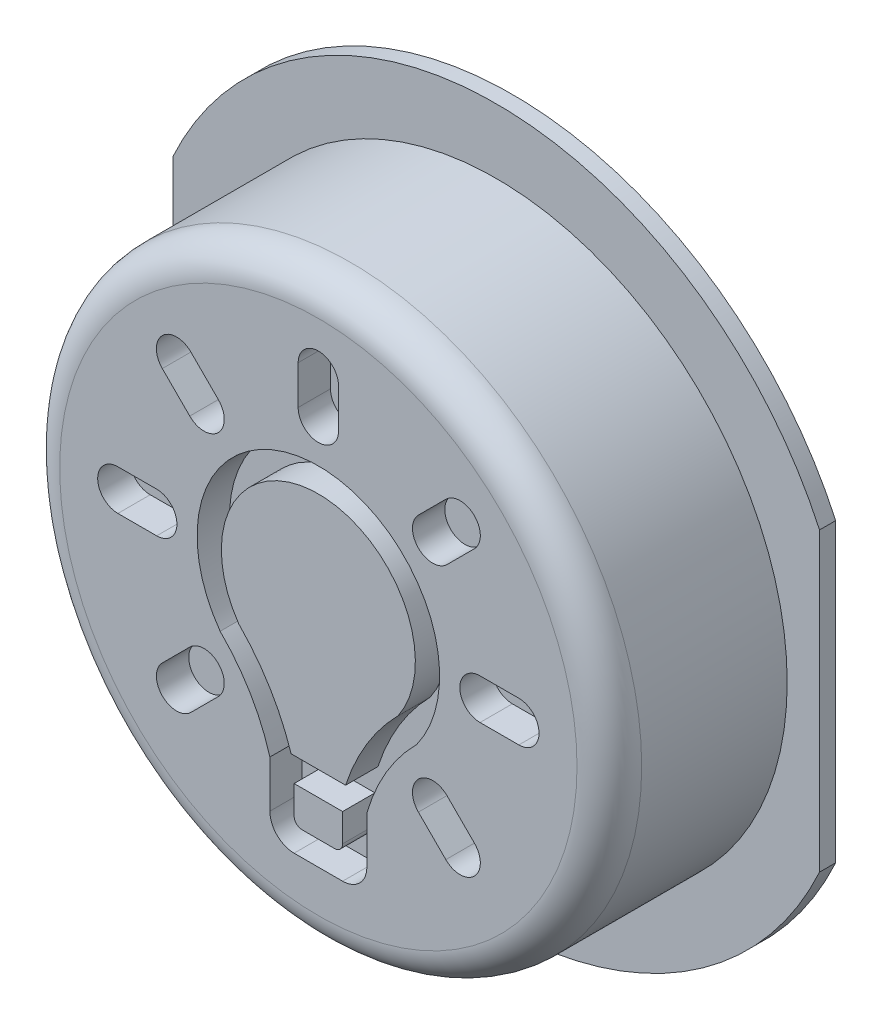
from build123d import *

# Parameters (mm, degrees)
ESBO_O1_R                = 9
RESSALTO_EXTRUS_O1_DEPTH = 6
FILETE1_R                = 1
CASCA1_T                 = -2
ESBO_O2_W                = 8.35
ESBO_O2_H                = 8.35
ESBO_O2_W_2              = 4.35
ESBO_O2_H_2              = 4.35
RESSALTO_EXTRUS_O2_DEPTH = 4
FILETE2_R                = 1
CORTE_EXTRUS_O2_DEPTH    = 1
ESBO_O6_R                = 11
ESBO_O6_R_2              = 9
RESSALTO_EXTRUS_O3_DEPTH = 0.5
CORTE_EXTRUS_O4_DEPTH    = 17.673332001
ESBO_O8_W                = 4.35
ESBO_O8_H                = 4.35
RESSALTO_EXTRUS_O4_DEPTH = 2


with BuildPart() as part:
    # Esboço1 → Ressalto-extrusão1 (new body)
    with BuildSketch(Plane.XY):
        Circle(ESBO_O1_R)
    extrude(amount=RESSALTO_EXTRUS_O1_DEPTH)

    # Filete1
    filete1_edges = [part.edges().sort_by_distance(p)[0] for p in [
        (-9, 0, 6),
    ]]
    fillet(filete1_edges, radius=FILETE1_R)

    # Casca1
    casca1_openings = [part.faces().sort_by_distance(p)[0] for p in [
        (0, 0, 0),
    ]]
    offset(amount=CASCA1_T, openings=casca1_openings, kind=Kind.INTERSECTION)

    # Esboço2 → Ressalto-extrusão2 (add)
    with BuildSketch(Plane(origin=(0, 0, 4), x_dir=(-1, 0, 0), z_dir=(0, 0, -1))):
        Rectangle(ESBO_O2_W, ESBO_O2_H)
        Rectangle(ESBO_O2_W_2, ESBO_O2_H_2, mode=Mode.SUBTRACT)
    extrude(amount=RESSALTO_EXTRUS_O2_DEPTH)

    # Filete2
    filete2_edges = [part.edges().sort_by_distance(p)[0] for p in [
        (-4.175, -4.175, 2),
        (-4.175, 4.175, 2),
        (4.175, 4.175, 2),
        (4.175, -4.175, 2),
    ]]
    fillet(filete2_edges, radius=FILETE2_R)

    # Esboço4 → Corte-extrusão2 (cut)
    # profile 1 of 8: a face of its own
    with BuildSketch(Plane.XY.offset(6)):
        with BuildLine():
            Line((-0.625, 6.5), (-0.625, 5.3))
            ThreePointArc((-0.625, 5.3), (0, 4.675), (0.625, 5.3))
            Line((0.625, 5.3), (0.625, 6.5))
            ThreePointArc((0.625, 6.5), (0, 7.125), (-0.625, 6.5))
        make_face()
    # profile 2 of 8: a face of its own
    with BuildSketch(Plane.XY.offset(6)):
        with BuildLine():
            Line((-1.5, -4.5), (-1.5, -5.95))
            ThreePointArc((-1.5, -5.95), (-1.280330086, -6.480330086), (-0.75, -6.7))
            Line((-0.75, -6.7), (0.75, -6.7))
            ThreePointArc((0.75, -6.7), (1.280330086, -6.480330086), (1.5, -5.95))
            Line((1.5, -5.95), (1.5, -4.5))
            ThreePointArc((1.5, -4.5), (2.102155122, -3.101716024), (3.036856928, -1.9))
            ThreePointArc((3.036856928, -1.9), (0, 4.05), (-3.036856928, -1.9))
            ThreePointArc((-3.036856928, -1.9), (-2.102155122, -3.101716024), (-1.5, -4.5))
        make_face()
        with BuildLine():
            Line((-0.842764128, -4.084062043), (0.842764128, -4.084062043))
            ThreePointArc((0.842764128, -4.084062043), (1.495755637, -2.654539881), (2.461620284, -1.414766916))
            ThreePointArc((2.461620284, -1.414766916), (0, 3.3), (-2.461620284, -1.414766916))
            ThreePointArc((-2.461620284, -1.414766916), (-1.495755637, -2.654539881), (-0.842764128, -4.084062043))
        make_face(mode=Mode.SUBTRACT)
        with BuildLine():
            Line((-0.75, -4.834062043), (0.75, -4.834062043))
            Line((0.75, -4.834062043), (0.75, -5.7))
            ThreePointArc((0.75, -5.7), (0.676776695, -5.876776695), (0.5, -5.95))
            Line((0.5, -5.95), (-0.5, -5.95))
            ThreePointArc((-0.5, -5.95), (-0.676776695, -5.876776695), (-0.75, -5.7))
            Line((-0.75, -5.7), (-0.75, -4.834062043))
        make_face(mode=Mode.SUBTRACT)
    # profile 3 of 8: a face of its own
    with BuildSketch(Plane.XY.offset(6)):
        with BuildLine():
            Line((3.942120305, 5.126003782), (3.093592168, 4.277475644))
            ThreePointArc((3.093592168, 4.277475644), (3.093592168, 3.393592168), (3.977475644, 3.393592168))
            Line((3.977475644, 3.393592168), (4.826003782, 4.242120305))
            ThreePointArc((4.826003782, 4.242120305), (4.826003782, 5.126003782), (3.942120305, 5.126003782))
        make_face()
    # profile 4 of 8: a face of its own
    with BuildSketch(Plane.XY.offset(6)):
        with BuildLine():
            Line((6.2, 0.925), (5, 0.925))
            ThreePointArc((5, 0.925), (4.375, 0.3), (5, -0.325))
            Line((5, -0.325), (6.2, -0.325))
            ThreePointArc((6.2, -0.325), (6.825, 0.3), (6.2, 0.925))
        make_face()
    # profile 5 of 8: a face of its own
    with BuildSketch(Plane.XY.offset(6)):
        with BuildLine():
            Line((4.826003782, -3.642120305), (3.977475644, -2.793592168))
            ThreePointArc((3.977475644, -2.793592168), (3.093592168, -2.793592168), (3.093592168, -3.677475644))
            Line((3.093592168, -3.677475644), (3.942120305, -4.526003782))
            ThreePointArc((3.942120305, -4.526003782), (4.826003782, -4.526003782), (4.826003782, -3.642120305))
        make_face()
    # profile 6 of 8: a face of its own
    with BuildSketch(Plane.XY.offset(6)):
        with BuildLine():
            Line((-3.942120305, -4.526003782), (-3.093592168, -3.677475644))
            ThreePointArc((-3.093592168, -3.677475644), (-3.093592168, -2.793592168), (-3.977475644, -2.793592168))
            Line((-3.977475644, -2.793592168), (-4.826003782, -3.642120305))
            ThreePointArc((-4.826003782, -3.642120305), (-4.826003782, -4.526003782), (-3.942120305, -4.526003782))
        make_face()
    # profile 7 of 8: a face of its own
    with BuildSketch(Plane.XY.offset(6)):
        with BuildLine():
            Line((-6.2, -0.325), (-5, -0.325))
            ThreePointArc((-5, -0.325), (-4.375, 0.3), (-5, 0.925))
            Line((-5, 0.925), (-6.2, 0.925))
            ThreePointArc((-6.2, 0.925), (-6.825, 0.3), (-6.2, -0.325))
        make_face()
    # profile 8 of 8: a face of its own
    with BuildSketch(Plane.XY.offset(6)):
        with BuildLine():
            Line((-4.826003782, 4.242120305), (-3.977475644, 3.393592168))
            ThreePointArc((-3.977475644, 3.393592168), (-3.093592168, 3.393592168), (-3.093592168, 4.277475644))
            Line((-3.093592168, 4.277475644), (-3.942120305, 5.126003782))
            ThreePointArc((-3.942120305, 5.126003782), (-4.826003782, 5.126003782), (-4.826003782, 4.242120305))
        make_face()
    extrude(amount=-CORTE_EXTRUS_O2_DEPTH, mode=Mode.SUBTRACT)

    # Esboço6 → Ressalto-extrusão3 (add)
    with BuildSketch(Plane(origin=(0, 0, 0), x_dir=(-1, 0, 0), z_dir=(0, 0, -1))):
        Circle(ESBO_O6_R)
        Circle(ESBO_O6_R_2, mode=Mode.SUBTRACT)
    extrude(amount=-RESSALTO_EXTRUS_O3_DEPTH)

    # Esboço7 → Corte-extrusão4 (cut, through all)
    with BuildSketch(Plane(origin=(0, 0, 0), x_dir=(-1, 0, 0), z_dir=(0, 0, -1))):
        with BuildLine():
            Line((-10, 4.582575695), (-10, -4.582575695))
            ThreePointArc((-10, -4.582575695), (-11, 0), (-10, 4.582575695))
        make_face()
        with BuildLine():
            Line((10, 4.582575695), (10, -4.582575695))
            ThreePointArc((10, -4.582575695), (11, 0), (10, 4.582575695))
        make_face()
    extrude(amount=-CORTE_EXTRUS_O4_DEPTH, mode=Mode.SUBTRACT)

    # Esboço8 → Ressalto-extrusão4 (add)
    with BuildSketch(Plane(origin=(0, 0, 4), x_dir=(-1, 0, 0), z_dir=(0, 0, -1))):
        Rectangle(ESBO_O8_W, ESBO_O8_H)
    extrude(amount=RESSALTO_EXTRUS_O4_DEPTH)


solid = part.part
